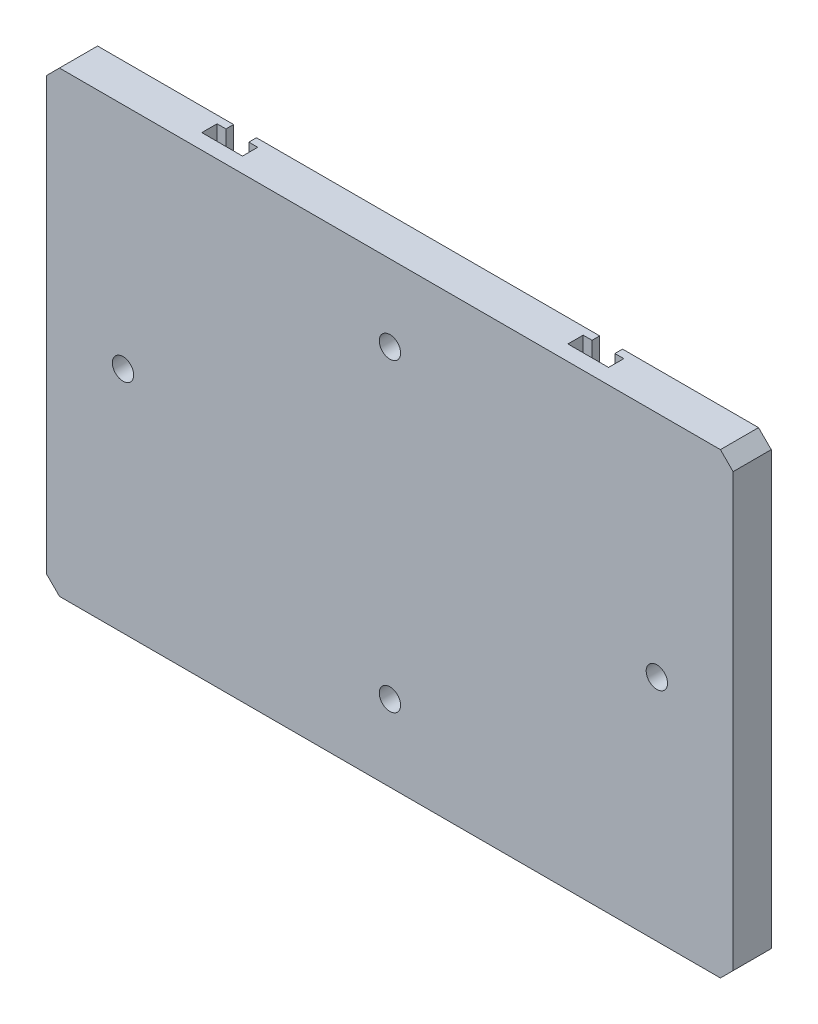
from build123d import *

# Parameters (mm, degrees)
SKETCH_1_W                   = 270
SKETCH_1_H                   = 180
EXTRUDE_1_DEPTH              = 15
CHAMFER_1_SIZE               = 5
HOLE_WIZARD_M8_1_D           = 8.4
HOLE_WIZARD_M8_1_CBORE_D     = 15
HOLE_WIZARD_M8_1_CBORE_DEPTH = 8
CUT_EXTRUDE_1_DEPTH          = 325.846117416


with BuildPart() as part:
    # 草图1 → 凸台-拉伸1 (new body)
    with BuildSketch(Plane.XY):
        with Locations((135, 90)):
            Rectangle(SKETCH_1_W, SKETCH_1_H)
    extrude(amount=EXTRUDE_1_DEPTH)

    # 倒角1
    chamfer_1_edges = [part.edges().sort_by_distance(p)[0] for p in [
        (0, 180, 7.5),
        (270, 180, 7.5),
        (270, 0, 7.5),
        (0, 0, 7.5),
    ]]
    chamfer(chamfer_1_edges, length=CHAMFER_1_SIZE)

    # M8 凹头盖螺钉的柱形沉头孔1 (through all)
    with Locations(Plane(origin=(0, 0, 0), x_dir=(-1, 0, 0), z_dir=(0, 0, -1))):
        with Locations((-240, 90), (-30, 90), (-135, 30), (-135, 150)):
            CounterBoreHole(HOLE_WIZARD_M8_1_D / 2, HOLE_WIZARD_M8_1_CBORE_D / 2, HOLE_WIZARD_M8_1_CBORE_DEPTH)

    # 草图4 → 切除-拉伸1 (cut, through all)
    with BuildSketch(Plane(origin=(0, 180, 0), x_dir=(1, 0, 0), z_dir=(0, 1, 0))):
        Polygon((55, -9), (71, -9), (71, -3), (67.5, -3), (67.5, 0), (58.5, 0), (58.5, -3), (55, -3), align=None)
        Polygon((202.5, -3), (199, -3), (199, -9), (215, -9), (215, -3), (211.5, -3), (211.5, 0), (202.5, 0), align=None)
    extrude(amount=-CUT_EXTRUDE_1_DEPTH, mode=Mode.SUBTRACT)


solid = part.part
